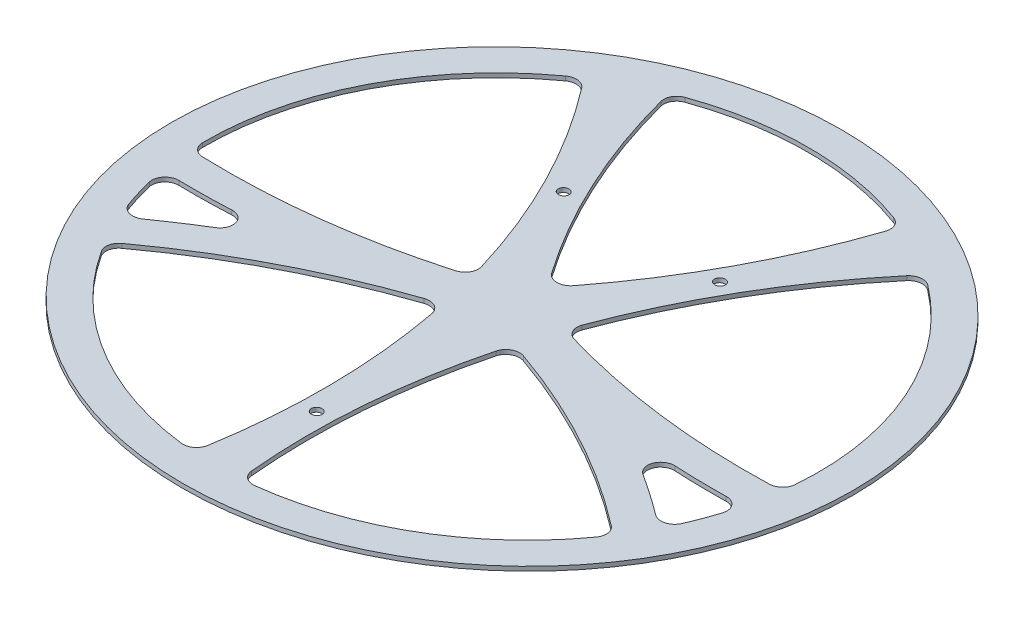
from build123d import *

# Parameters (mm, degrees)
SKETCH1_R           = 248.894047882
SKETCH1_R_2         = 4
BOSS_EXTRUDE1_DEPTH = 1.5875


with BuildPart() as part:
    # Sketch1 → Boss-Extrude1 (new, symmetric)
    with BuildSketch(Plane(origin=(0, 79.166310833, -2.766864901), x_dir=(0, -0.03492870325036397, -0.9993898066766781), z_dir=(0, -0.9993898066766781, 0.03492870325036397))):
        with Locations((28.500583785, 0)):
            Circle(SKETCH1_R)
        with Locations((-119.119809099, 0)):
            Circle(SKETCH1_R_2, mode=Mode.SUBTRACT)
        with Locations((126.54316519, -59)):
            Circle(SKETCH1_R_2, mode=Mode.SUBTRACT)
        with Locations((126.54316519, 59)):
            Circle(SKETCH1_R_2, mode=Mode.SUBTRACT)
        with BuildLine():
            ThreePointArc((238.081851524, -78.766978422), (252.394631667, 0), (238.081851524, 78.766978422))
            ThreePointArc((238.081851524, 78.766978422), (233.209259095, 84.18518249), (225.953504109, 84.858318353))
            ThreePointArc((225.953504109, 84.858318353), (143.037826046, 53.222841583), (66.585433619, 8.157946694))
            ThreePointArc((66.585433619, 8.157946694), (62.36885006, 0), (66.585433619, -8.157946694))
            ThreePointArc((66.585433619, -8.157946694), (143.037826046, -53.222841583), (225.953504109, -84.858318353))
            ThreePointArc((225.953504109, -84.858318353), (233.209259095, -84.18518249), (238.081851524, -78.766978422))
        make_face(mode=Mode.SUBTRACT)
        with BuildLine():
            ThreePointArc((-184.986589143, 16.62098717), (-96.058103224, 13.003455955), (-7.783793413, 24.361640995))
            ThreePointArc((-7.783793413, 24.361640995), (-1.152695169, 29.274262086), (-0.472616045, 37.498786528))
            ThreePointArc((-0.472616045, 37.498786528), (-35.031535638, 114.339868269), (-81.363716284, 184.71173625))
            ThreePointArc((-81.363716284, 184.71173625), (-87.629404707, 188.431983672), (-94.756155234, 186.912602473))
            ThreePointArc((-94.756155234, 186.912602473), (-161.65529586, 118.191734539), (-193.66286294, 27.783945296))
            ThreePointArc((-193.66286294, 27.783945296), (-191.635746069, 20.406253949), (-184.986589143, 16.62098717))
        make_face(mode=Mode.SUBTRACT)
        with BuildLine():
            ThreePointArc((-184.986589143, -16.62098717), (-96.058103224, -13.003455955), (-7.783793413, -24.361640995))
            ThreePointArc((-7.783793413, -24.361640995), (-1.152695169, -29.274262086), (-0.472616045, -37.498786528))
            ThreePointArc((-0.472616045, -37.498786528), (-35.031535638, -114.339868269), (-81.363716284, -184.71173625))
            ThreePointArc((-81.363716284, -184.71173625), (-87.629404707, -188.431983672), (-94.756155234, -186.912602473))
            ThreePointArc((-94.756155234, -186.912602473), (-161.65529586, -118.191734539), (-193.66286294, -27.783945296))
            ThreePointArc((-193.66286294, -27.783945296), (-191.635746069, -20.406253949), (-184.986589143, -16.62098717))
        make_face(mode=Mode.SUBTRACT)
        with BuildLine():
            ThreePointArc((205.754686462, 136.78277582), (122.671836524, 203.126364203), (18.352909122, 223.663965305))
            ThreePointArc((18.352909122, 223.663965305), (11.694176969, 220.704171659), (8.811835123, 214.01154902))
            ThreePointArc((8.811835123, 214.01154902), (12.86563705, 128.486999921), (30.677726566, 44.739693841))
            ThreePointArc((30.677726566, 44.739693841), (35.60655975, 38.753388876), (43.332423143, 38.089854005))
            ThreePointArc((43.332423143, 38.089854005), (127.305687629, 73.474816574), (203.951454434, 122.760018767))
            ThreePointArc((203.951454434, 122.760018767), (207.756142558, 129.39808179), (205.754686462, 136.78277582))
        make_face(mode=Mode.SUBTRACT)
        with BuildLine():
            ThreePointArc((8.811835123, -214.01154902), (12.86563705, -128.486999921), (30.677726566, -44.739693841))
            ThreePointArc((30.677726566, -44.739693841), (35.60655975, -38.753388876), (43.332423143, -38.089854005))
            ThreePointArc((43.332423143, -38.089854005), (127.305687629, -73.474816574), (203.951454434, -122.760018767))
            ThreePointArc((203.951454434, -122.760018767), (207.756142558, -129.39808179), (205.754686462, -136.78277582))
            ThreePointArc((205.754686462, -136.78277582), (122.671836524, -203.126364203), (18.352909122, -223.663965305))
            ThreePointArc((18.352909122, -223.663965305), (11.694176969, -220.704171659), (8.811835123, -214.01154902))
        make_face(mode=Mode.SUBTRACT)
        with BuildLine():
            ThreePointArc((-52.210070583, -208.840453333), (-40.68648195, -212.935893198), (-28.956463756, -216.3960082))
            ThreePointArc((-28.956463756, -216.3960082), (-20.219684914, -214.600125685), (-16.391954321, -206.543763165))
            ThreePointArc((-16.391954321, -206.543763165), (-16.412181984, -186.973684298), (-15.74049523, -167.415125227))
            ThreePointArc((-15.74049523, -167.415125227), (-22.636803093, -157.38469373), (-34.111773062, -161.445935215))
            ThreePointArc((-34.111773062, -161.445935215), (-45.06459964, -177.663949457), (-56.583967908, -193.484586319))
            ThreePointArc((-56.583967908, -193.484586319), (-58.222679885, -202.252204103), (-52.210070583, -208.840453333))
        make_face(mode=Mode.SUBTRACT)
        with BuildLine():
            ThreePointArc((-16.391954321, 206.543763165), (-16.412181984, 186.973684298), (-15.74049523, 167.415125227))
            ThreePointArc((-15.74049523, 167.415125227), (-22.636803093, 157.38469373), (-34.111773062, 161.445935215))
            ThreePointArc((-34.111773062, 161.445935215), (-45.06459964, 177.663949457), (-56.583967908, 193.484586319))
            ThreePointArc((-56.583967908, 193.484586319), (-58.222679885, 202.252204103), (-52.210070583, 208.840453333))
            ThreePointArc((-52.210070583, 208.840453333), (-40.68648195, 212.935893198), (-28.956463756, 216.3960082))
            ThreePointArc((-28.956463756, 216.3960082), (-20.219684914, 214.600125685), (-16.391954321, 206.543763165))
        make_face(mode=Mode.SUBTRACT)
    extrude(amount=BOSS_EXTRUDE1_DEPTH, both=True)


solid = part.part
